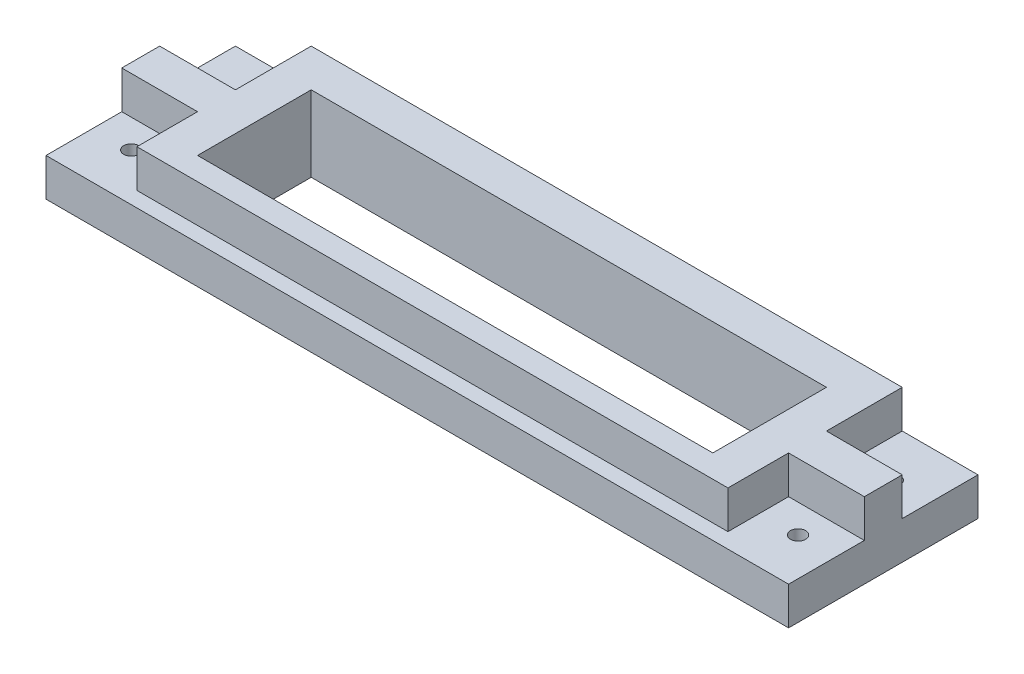
from build123d import *

# Parameters (mm, degrees)
SKETCH1_W           = 78
SKETCH1_H           = 25
BOSS_EXTRUDE1_DEPTH = 10
SKETCH2_W           = 68
SKETCH2_H           = 15
CUT_EXTRUDE2_DEPTH  = 10
SKETCH3_W           = 25
SKETCH3_H           = 5
BOSS_EXTRUDE2_DEPTH = 10
SKETCH4_W           = 25
SKETCH4_H           = 5
BOSS_EXTRUDE3_DEPTH = 10
SKETCH6_W           = 10
SKETCH6_H           = 5
BOSS_EXTRUDE4_DEPTH = 5
SKETCH9_R           = 1.75
CUT_EXTRUDE5_DEPTH  = 2
SKETCH10_R          = 1
CUT_EXTRUDE6_DEPTH  = 13
SKETCH11_W          = 78
SKETCH11_H          = 5
CUT_EXTRUDE7_DEPTH  = 2


with BuildPart() as part:
    # Sketch1 → Boss-Extrude1 (new body)
    with BuildSketch(Plane(origin=(0, 0, 0), x_dir=(1, 0, 0), z_dir=(0, 1, 0))):
        Rectangle(SKETCH1_W, SKETCH1_H)
    extrude(amount=BOSS_EXTRUDE1_DEPTH)

    # Sketch2 → Cut-Extrude2 (cut)
    with BuildSketch(Plane(origin=(0, 10, 0), x_dir=(1, 0, 0), z_dir=(0, 1, 0))):
        Rectangle(SKETCH2_W, SKETCH2_H)
    extrude(amount=-CUT_EXTRUDE2_DEPTH, mode=Mode.SUBTRACT)

    # Sketch3 → Boss-Extrude2 (add)
    with BuildSketch(Plane.ZY.offset(39)):
        with Locations((0, 2.5)):
            Rectangle(SKETCH3_W, SKETCH3_H)
    extrude(amount=BOSS_EXTRUDE2_DEPTH)

    # Sketch4 → Boss-Extrude3 (add)
    with BuildSketch(Plane(origin=(39, 0, 0), x_dir=(0, 0, -1), z_dir=(1, 0, 0))):
        with Locations((0, 2.5)):
            Rectangle(SKETCH4_W, SKETCH4_H)
    extrude(amount=BOSS_EXTRUDE3_DEPTH)

    # Sketch6 → Boss-Extrude4 (add)
    with BuildSketch(Plane(origin=(0, 5, 0), x_dir=(1, 0, 0), z_dir=(0, 1, 0))):
        with Locations((44, 0)):
            Rectangle(SKETCH6_W, SKETCH6_H)
        with Locations((-44, 0)):
            Rectangle(SKETCH6_W, SKETCH6_H)
    extrude(amount=BOSS_EXTRUDE4_DEPTH)

    # Sketch9 → Cut-Extrude5 (cut)
    with BuildSketch(Plane.XZ):
        with Locations(Location((-44, 6.25, 0), (0, 0, 270))):
            Circle(SKETCH9_R)
        with Locations(Location((-44, -6.25, 0), (0, 0, 270))):
            Circle(SKETCH9_R)
        with Locations(Location((44, 6.25, 0), (0, 0, 270))):
            Circle(SKETCH9_R)
        with Locations(Location((44, -6.25, 0), (0, 0, 270))):
            Circle(SKETCH9_R)
    extrude(amount=-CUT_EXTRUDE5_DEPTH, mode=Mode.SUBTRACT)

    # Sketch10 → Cut-Extrude6 (cut)
    with BuildSketch(Plane.XZ.offset(-2)):
        with Locations(Location((-44, 6.25, 0), (0, 0, 270))):
            Circle(SKETCH10_R)
        with Locations(Location((-44, -6.25, 0), (0, 0, 270))):
            Circle(SKETCH10_R)
        with Locations(Location((44, 6.25, 0), (0, 0, 270))):
            Circle(SKETCH10_R)
        with Locations(Location((44, -6.25, 0), (0, 0, 270))):
            Circle(SKETCH10_R)
    extrude(amount=-CUT_EXTRUDE6_DEPTH, mode=Mode.SUBTRACT)

    # Sketch11 → Cut-Extrude7 (cut)
    with BuildSketch(Plane.XY.offset(12.5)):
        with Locations((0, 7.5)):
            Rectangle(SKETCH11_W, SKETCH11_H)
    extrude(amount=-CUT_EXTRUDE7_DEPTH, mode=Mode.SUBTRACT)


solid = part.part
